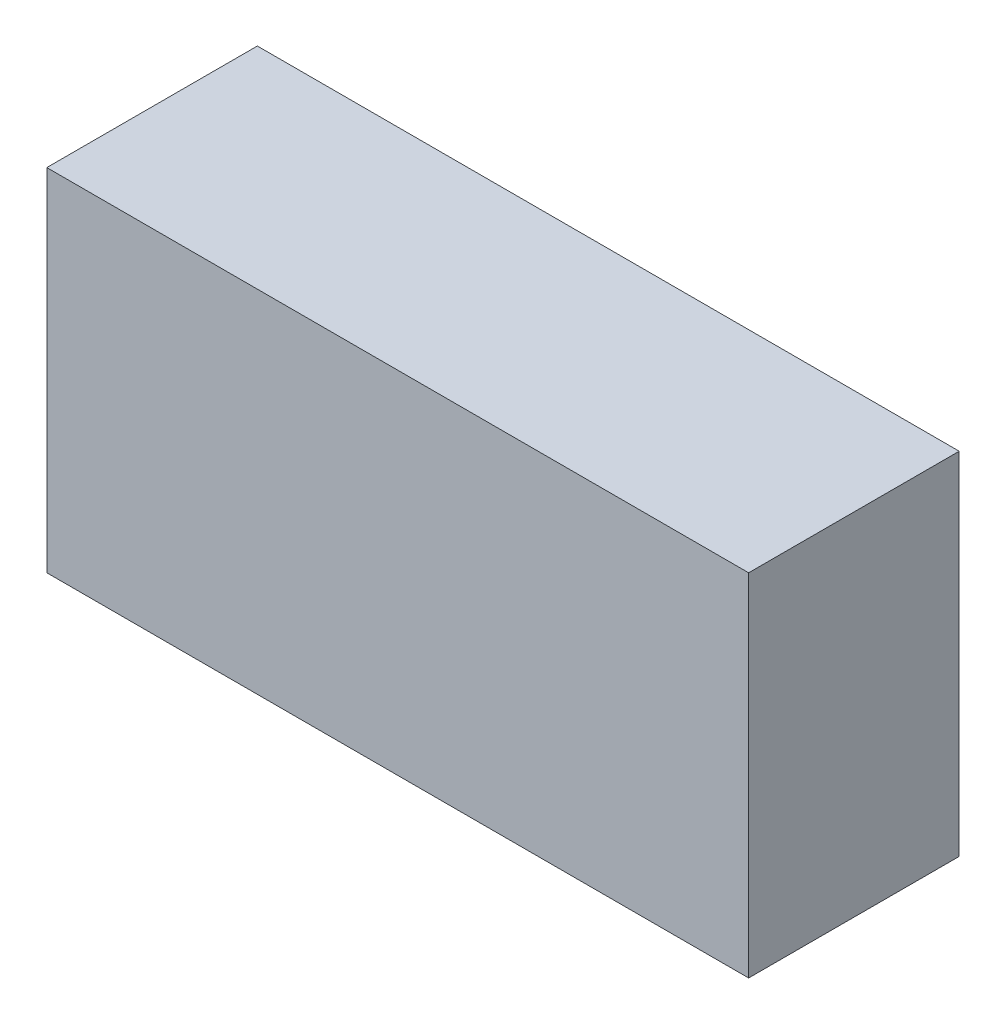
from build123d import *

# Parameters (mm, degrees)
SKETCH1_W           = 10
SKETCH1_H           = 5
BOSS_EXTRUDE1_DEPTH = 3


with BuildPart() as part:
    # Sketch1 → Boss-Extrude1 (new body)
    with BuildSketch(Plane.XY):
        with Locations((5, 2.5)):
            Rectangle(SKETCH1_W, SKETCH1_H)
    extrude(amount=BOSS_EXTRUDE1_DEPTH)


solid = part.part
